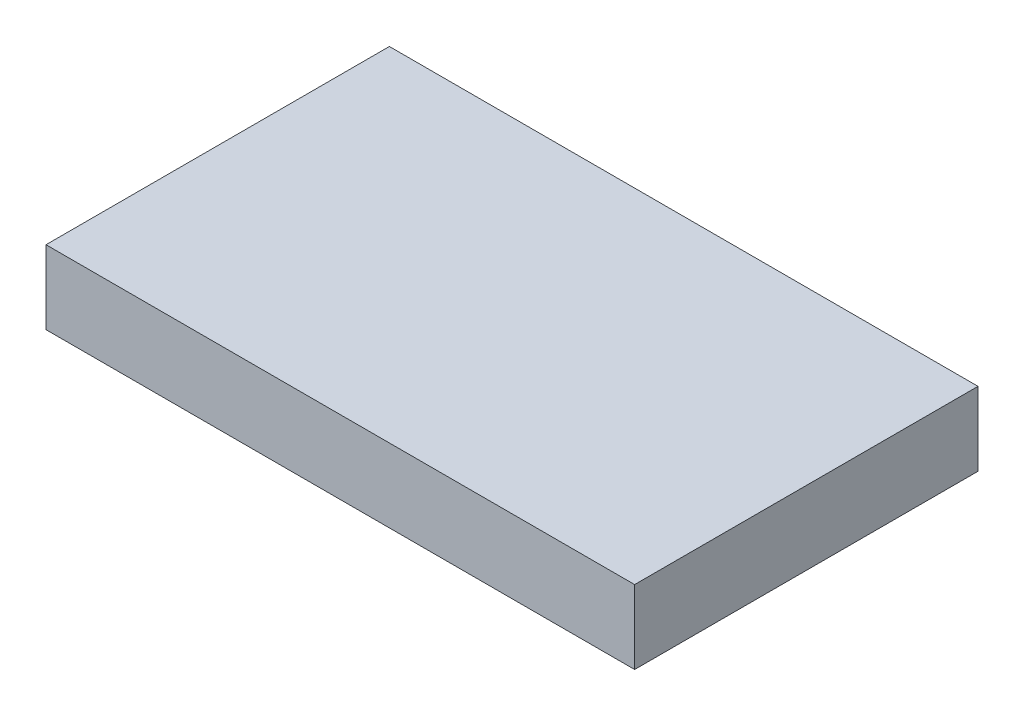
from build123d import *

# Parameters (mm, degrees)
SKETCH1_W           = 76.2
SKETCH1_H           = 44.45
BOSS_EXTRUDE1_DEPTH = 9.525


with BuildPart() as part:
    # Sketch1 → Boss-Extrude1 (new body)
    with BuildSketch(Plane(origin=(0, 0, 0), x_dir=(1, 0, 0), z_dir=(0, 1, 0))):
        with Locations((38.1, 22.225)):
            Rectangle(SKETCH1_W, SKETCH1_H)
    extrude(amount=BOSS_EXTRUDE1_DEPTH)


solid = part.part
